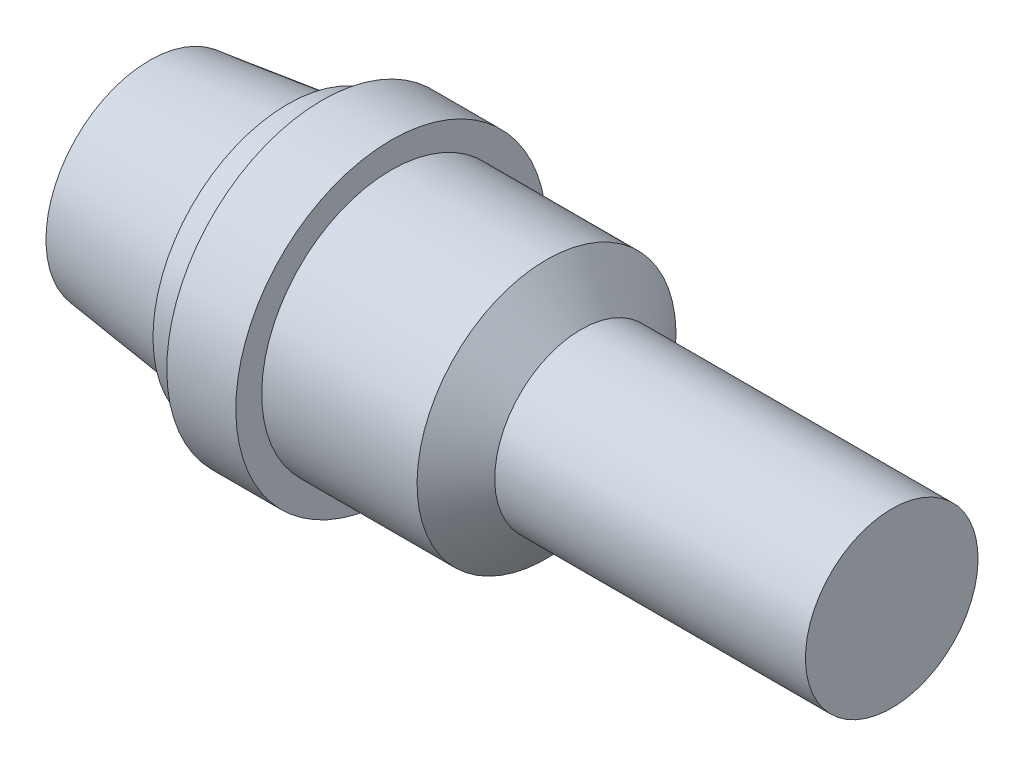
from build123d import *

# Parameters (mm, degrees)
ENL_V_MAT_EXTRU_1_DEPTH = 0.5


with BuildPart() as part:
    # Esquisse1 → Révolution1 (revolve)
    with BuildSketch(Plane.XY):
        Polygon((0, 0), (0, 6), (8, 7), (8, 7.8), (10, 7.8), (10, 9), (14, 9), (14, 7.5), (23, 7.5), (25, 5), (43, 5), (43, 0), align=None)
    revolve(axis=Axis((43, 0, 0), (-1, 0, 0)))

    # Esquisse2 → Enlèv. mat.-Extru.1 (cut)
    with BuildSketch(Plane.ZY):
        Polygon((-4.875358722, 1.453351733), (-3.170230517, 1.453351733), (-3.170230517, 0.825146605), (-4.247153594, 0.825146605), (-4.247153594, 0.152069681), (-3.170230517, 0.152069681), (-3.170230517, -0.476135447), (-4.247153594, -0.476135447), (-4.247153594, -2.046648267), (-4.875358722, -2.046648267), align=None)
        with BuildLine():
            Line((-2.542025389, 1.453351733), (-1.913820261, 1.453351733))
            Line((-1.913820261, 1.453351733), (-1.913820261, -0.823891857))
            add(Edge.make_bspline(
                [(-1.913820261, -0.823891857), (-1.913786102, -0.847501331), (-1.913720125, -0.893102786), (-1.910417274, -0.958525943), (-1.907394937, -1.018663523), (-1.901941783, -1.073449687), (-1.893885606, -1.122907872), (-1.886084598, -1.167355779), (-1.875526705, -1.205997618), (-1.85965988, -1.249982148), (-1.835214311, -1.299401169), (-1.795271608, -1.350906807), (-1.749181145, -1.397913177), (-1.693939071, -1.437039499), (-1.631851865, -1.468689167), (-1.563260669, -1.492138068), (-1.488262172, -1.505172543), (-1.436404826, -1.507162495), (-1.40971369, -1.508186729)],
                knots=[0, 0, 0, 0, 1.155499968, 2.231836252, 3.205919964, 4.102923608, 4.924856345, 5.658536265, 6.31071849, 6.882491295, 7.94666036, 8.992281882, 10.060072772, 11.158554251, 12.289267114, 13.461410017, 14.693379945, 16, 16, 16, 16], degree=3))
            add(Edge.make_bspline(
                [(-1.40971369, -1.508186729), (-1.381357653, -1.507359279), (-1.32606818, -1.505745892), (-1.246543076, -1.489908754), (-1.172862616, -1.464690607), (-1.106586867, -1.428697883), (-1.047781783, -1.385554296), (-0.998004512, -1.336357087), (-0.958720473, -1.281008132), (-0.933116597, -1.229944507), (-0.918741282, -1.182944886), (-0.907966267, -1.140952508), (-0.90006699, -1.091405659), (-0.892900505, -1.03507812), (-0.888594, -0.971386445), (-0.883924297, -0.900842851), (-0.882212808, -0.822964661), (-0.881921097, -0.768736616), (-0.881768979, -0.740458363)],
                knots=[0, 0, 0, 0, 1.261321664, 2.459363699, 3.594844139, 4.716940403, 5.803436589, 6.833651888, 7.818396249, 8.814403945, 9.360733334, 10.004355033, 10.743453831, 11.592799886, 12.532235708, 13.585170094, 14.740740724, 16, 16, 16, 16], degree=3))
            Line((-0.881768979, -0.740458363), (-0.881768979, 1.453351733))
            Line((-0.881768979, 1.453351733), (-0.253563851, 1.453351733))
            Line((-0.253563851, 1.453351733), (-0.253563851, -0.634588972))
            add(Edge.make_bspline(
                [(-0.253563851, -0.634588972), (-0.253651088, -0.676890551), (-0.253818838, -0.758232362), (-0.256394966, -0.875126268), (-0.261879076, -0.981890101), (-0.266485097, -1.078555056), (-0.275399323, -1.16499091), (-0.284685856, -1.241566769), (-0.296522341, -1.308011265), (-0.314134319, -1.383650249), (-0.344527379, -1.47074577), (-0.393524976, -1.571032485), (-0.455724254, -1.669219255), (-0.529240693, -1.764225956), (-0.612247477, -1.852484119), (-0.702904168, -1.929963362), (-0.799770457, -1.995502448), (-0.903858527, -2.047498865), (-1.015079794, -2.08805215), (-1.134534709, -2.115301916), (-1.262141813, -2.133712199), (-1.350282452, -2.135480733), (-1.395691254, -2.136391857)],
                knots=[0, 0, 0, 0, 1.170808336, 2.251350247, 3.235597562, 4.129743112, 4.929140599, 5.639994148, 6.264258765, 6.79612947, 7.788252245, 8.809469599, 9.879094798, 10.999557536, 12.129761673, 13.226370002, 14.293821979, 15.358369427, 16.438775801, 17.562147481, 18.744053101, 20, 20, 20, 20], degree=3))
            add(Edge.make_bspline(
                [(-1.395691254, -2.136391857), (-1.425861766, -2.135883675), (-1.485387566, -2.134881041), (-1.572930698, -2.126040433), (-1.657558331, -2.1130127), (-1.739111452, -2.09400658), (-1.817873115, -2.069454223), (-1.893822396, -2.039231981), (-1.966677049, -2.00350843), (-2.03602939, -1.962612149), (-2.101794073, -1.918389862), (-2.1618996, -1.869367596), (-2.218414341, -1.819170731), (-2.269705609, -1.765686771), (-2.316158648, -1.709477207), (-2.357677788, -1.650414648), (-2.394201344, -1.588504341), (-2.426648047, -1.522630358), (-2.454419258, -1.449444559), (-2.477831432, -1.366343698), (-2.498284859, -1.27202525), (-2.513484638, -1.166276722), (-2.527264848, -1.049446648), (-2.53598696, -0.921230668), (-2.54054989, -0.781625105), (-2.541521128, -0.684839462), (-2.542025389, -0.634588972)],
                knots=[0, 0, 0, 0, 1.001158378, 1.975264943, 2.917723546, 3.841610987, 4.75185031, 5.653588123, 6.552117133, 7.442167995, 8.324307438, 9.179605724, 10.014504199, 10.831958861, 11.636465792, 12.43274043, 13.225645099, 14.020104002, 14.867201867, 15.819789774, 16.883317127, 18.068162734, 19.364263498, 20.787406516, 22.332041935, 24, 24, 24, 24], degree=3))
            Line((-2.542025389, -0.634588972), (-2.542025389, 1.453351733))
        make_face()
        with BuildLine():
            Line((2.349000252, 0.985703496), (1.879248649, 0.555915835))
            add(Edge.make_bspline(
                [(1.879248649, 0.555915835), (1.859126505, 0.584300212), (1.820494794, 0.638794257), (1.75787682, 0.711763067), (1.695541597, 0.774010892), (1.63291163, 0.82527769), (1.569431788, 0.865251977), (1.505212264, 0.893554213), (1.440617137, 0.911546214), (1.397219182, 0.913786651), (1.375843201, 0.914890194)],
                knots=[0, 0, 0, 0, 1.299362458, 2.494594718, 3.587462134, 4.587049575, 5.512617175, 6.380583204, 7.202344345, 8, 8, 8, 8], degree=3))
            add(Edge.make_bspline(
                [(1.375843201, 0.914890194), (1.355904298, 0.914190938), (1.317407516, 0.912840859), (1.262527497, 0.89942117), (1.213804234, 0.876260758), (1.17128528, 0.84597657), (1.137603995, 0.809491145), (1.110712101, 0.771227316), (1.095569704, 0.728992701), (1.093576667, 0.699984264), (1.092589996, 0.685623367)],
                knots=[0, 0, 0, 0, 1.185010067, 2.2879431, 3.333075148, 4.379039566, 5.372662701, 6.27520591, 7.14612461, 8, 8, 8, 8], degree=3))
            add(Edge.make_bspline(
                [(1.092589996, 0.685623367), (1.093208293, 0.67105538), (1.094453457, 0.641717477), (1.106480051, 0.598719128), (1.124607562, 0.556704735), (1.141929139, 0.531128574), (1.150783105, 0.518055258)],
                knots=[0, 0, 0, 0, 0.967525499, 1.948461899, 2.951351359, 4, 4, 4, 4], degree=3))
            add(Edge.make_bspline(
                [(1.150783105, 0.518055258), (1.158832317, 0.507893507), (1.177360542, 0.484502496), (1.212690071, 0.447454782), (1.257056539, 0.40206809), (1.312167263, 0.349903134), (1.375734444, 0.289083859), (1.450704502, 0.222001094), (1.534919474, 0.146577364), (1.594777524, 0.094055009), (1.626143681, 0.066532822)],
                knots=[0, 0, 0, 0, 0.473873513, 1.090794244, 1.870441696, 2.795289791, 3.865433203, 5.087734844, 6.473946851, 8, 8, 8, 8], degree=3))
            add(Edge.make_bspline(
                [(1.626143681, 0.066532822), (1.655585332, 0.041052559), (1.711459468, -0.007303687), (1.790957268, -0.075937615), (1.860822593, -0.137685886), (1.922073223, -0.191621791), (1.973780658, -0.238311242), (2.016162276, -0.277977412), (2.049735695, -0.309848076), (2.068820219, -0.329097976), (2.076964996, -0.337313331)],
                knots=[0, 0, 0, 0, 1.543621617, 2.929473131, 4.163658386, 5.240097082, 6.164993805, 6.925417477, 7.541396219, 8, 8, 8, 8], degree=3))
            add(Edge.make_bspline(
                [(2.076964996, -0.337313331), (2.10786458, -0.370753299), (2.167264433, -0.435036662), (2.244463302, -0.534655657), (2.308000468, -0.631904108), (2.357154024, -0.728611904), (2.394276767, -0.826174346), (2.420448793, -0.926984146), (2.436123393, -1.032094704), (2.43786364, -1.103819828), (2.438743842, -1.140097786)],
                knots=[0, 0, 0, 0, 1.206664779, 2.319633467, 3.337109185, 4.282041471, 5.190008762, 6.099243693, 7.03861361, 8, 8, 8, 8], degree=3))
            add(Edge.make_bspline(
                [(2.438743842, -1.140097786), (2.438117336, -1.175446208), (2.43688811, -1.244801126), (2.421832442, -1.346291719), (2.400363944, -1.44342262), (2.367169879, -1.53513691), (2.32671315, -1.622940049), (2.275994796, -1.705464344), (2.216433044, -1.783544975), (2.148166131, -1.855786156), (2.072654819, -1.921340019), (1.991661761, -1.979697617), (1.904394965, -2.027879247), (1.811600025, -2.067553383), (1.713326613, -2.098110933), (1.609691801, -2.120695811), (1.500537073, -2.134250898), (1.425895497, -2.135667922), (1.387762271, -2.136391857)],
                knots=[0, 0, 0, 0, 1.043214005, 2.046824704, 3.02475056, 3.976699089, 4.921714032, 5.875962561, 6.831408892, 7.817874052, 8.806269674, 9.781291748, 10.760897367, 11.74438705, 12.757449933, 13.795994037, 14.874007457, 16, 16, 16, 16], degree=3))
            add(Edge.make_bspline(
                [(1.387762271, -2.136391857), (1.357828013, -2.135860803), (1.298541016, -2.134809012), (1.211160944, -2.126222016), (1.126785607, -2.112363517), (1.045510047, -2.092500148), (0.966968101, -2.067330565), (0.891156545, -2.036586884), (0.818598731, -1.999792589), (0.748745652, -1.957704317), (0.681936881, -1.90883429), (0.617327646, -1.854181638), (0.555559708, -1.79290578), (0.496336408, -1.725151631), (0.440036673, -1.650727327), (0.384817611, -1.570669365), (0.333133323, -1.483491977), (0.30120564, -1.422336334), (0.284897688, -1.391099389)],
                knots=[0, 0, 0, 0, 1.016823716, 2.013894106, 2.979844003, 3.91962641, 4.853723003, 5.779685073, 6.695824784, 7.614987388, 8.547259901, 9.504950863, 10.487499108, 11.500346958, 12.559593716, 13.656357062, 14.802919212, 16, 16, 16, 16], degree=3))
            Line((0.284897688, -1.391099389), (0.837381662, -1.05946878))
            add(Edge.make_bspline(
                [(0.837381662, -1.05946878), (0.857780473, -1.094926794), (0.896886736, -1.162902837), (0.963155955, -1.254237266), (1.031045387, -1.332450086), (1.102124575, -1.39615888), (1.175529222, -1.446215516), (1.251613889, -1.481989462), (1.330432033, -1.504133493), (1.384119372, -1.506837791), (1.41089929, -1.508186729)],
                knots=[0, 0, 0, 0, 1.283663364, 2.460892379, 3.537111102, 4.529833553, 5.449777664, 6.316464042, 7.160231139, 8, 8, 8, 8], degree=3))
            add(Edge.make_bspline(
                [(1.41089929, -1.508186729), (1.438138301, -1.507085113), (1.49098595, -1.504947818), (1.566419205, -1.485206271), (1.63557927, -1.454210594), (1.695360719, -1.409984037), (1.745979881, -1.358939868), (1.783339728, -1.302150896), (1.806809436, -1.240706599), (1.809290753, -1.198023349), (1.810538713, -1.17655612)],
                knots=[0, 0, 0, 0, 1.13588714, 2.203786484, 3.234766741, 4.283437687, 5.291419208, 6.222934724, 7.106237994, 8, 8, 8, 8], degree=3))
            add(Edge.make_bspline(
                [(1.810538713, -1.17655612), (1.809386273, -1.156584357), (1.807045201, -1.116013631), (1.789801585, -1.055691487), (1.762844554, -0.995396776), (1.730952485, -0.945941422), (1.698498312, -0.904533795), (1.667464802, -0.86865596), (1.629674197, -0.829017233), (1.585222316, -0.785567751), (1.534696484, -0.737925019), (1.478054142, -0.686093701), (1.414646673, -0.63053037), (1.369830148, -0.592681177), (1.346396085, -0.572890254)],
                knots=[0, 0, 0, 0, 0.916159276, 1.861089862, 2.860218735, 3.940849679, 4.552606315, 5.27541173, 6.11797699, 7.06649574, 8.129236253, 9.306560635, 10.591630461, 12, 12, 12, 12], degree=3))
            add(Edge.make_bspline(
                [(1.346396085, -0.572890254), (1.301846999, -0.535197455), (1.216343818, -0.462853565), (1.095516976, -0.356003917), (0.986641172, -0.25614313), (0.890656775, -0.162036707), (0.806340796, -0.075422576), (0.734264259, 0.004402778), (0.675218956, 0.078055096), (0.613086508, 0.165291339), (0.554048259, 0.271594695), (0.503022458, 0.399489955), (0.469919073, 0.527368988), (0.466210299, 0.613219927), (0.464384867, 0.65547513)],
                knots=[0, 0, 0, 0, 1.345494975, 2.582412109, 3.71882943, 4.751509156, 5.681369928, 6.505683931, 7.230279997, 7.856715994, 8.973648664, 10.023341002, 11.027102913, 12, 12, 12, 12], degree=3))
            add(Edge.make_bspline(
                [(0.464384867, 0.65547513), (0.465144062, 0.685440253), (0.466639756, 0.744474762), (0.479981584, 0.831276408), (0.499921453, 0.915032702), (0.528879868, 0.995438064), (0.566464393, 1.072391783), (0.61210934, 1.14627058), (0.666523487, 1.216394492), (0.727844557, 1.282717029), (0.795404676, 1.343328282), (0.867601249, 1.396823785), (0.944025637, 1.442006865), (1.024210315, 1.479489511), (1.108652152, 1.508180095), (1.19672907, 1.528517411), (1.2885674, 1.540613398), (1.35103385, 1.542257707), (1.382854419, 1.543095322)],
                knots=[0, 0, 0, 0, 1.010766082, 1.991317756, 2.957454644, 3.913069143, 4.869106762, 5.843196583, 6.838735724, 7.860187025, 8.887984031, 9.89767229, 10.887916223, 11.879572884, 12.879850636, 13.892031539, 14.926195476, 16, 16, 16, 16], degree=3))
            add(Edge.make_bspline(
                [(1.382854419, 1.543095322), (1.424092301, 1.541586753), (1.506242549, 1.538581522), (1.62770406, 1.515081597), (1.746342585, 1.478125489), (1.841943733, 1.433542011), (1.918011781, 1.390353975), (1.976310834, 1.350591872), (2.035633259, 1.305042245), (2.096457454, 1.253561557), (2.157653211, 1.195179842), (2.220960618, 1.131286925), (2.285517035, 1.06133062), (2.327468471, 1.01135416), (2.349000252, 0.985703496)],
                knots=[0, 0, 0, 0, 1.282922637, 2.555718331, 3.837320111, 5.142675274, 5.830281639, 6.55870424, 7.337177975, 8.157850921, 9.037902056, 9.96903443, 10.957596896, 12, 12, 12, 12], degree=3))
        make_face()
        Polygon((3.06694897, 1.453351733), (4.951564355, 1.453351733), (4.951564355, 0.825146605), (3.695154098, 0.825146605), (3.695154098, 0.152069681), (4.951564355, 0.152069681), (4.951564355, -0.476135447), (3.695154098, -0.476135447), (3.695154098, -1.418443139), (4.951564355, -1.418443139), (4.951564355, -2.046648267), (3.06694897, -2.046648267), align=None)
    extrude(amount=-ENL_V_MAT_EXTRU_1_DEPTH, mode=Mode.SUBTRACT)


solid = part.part
